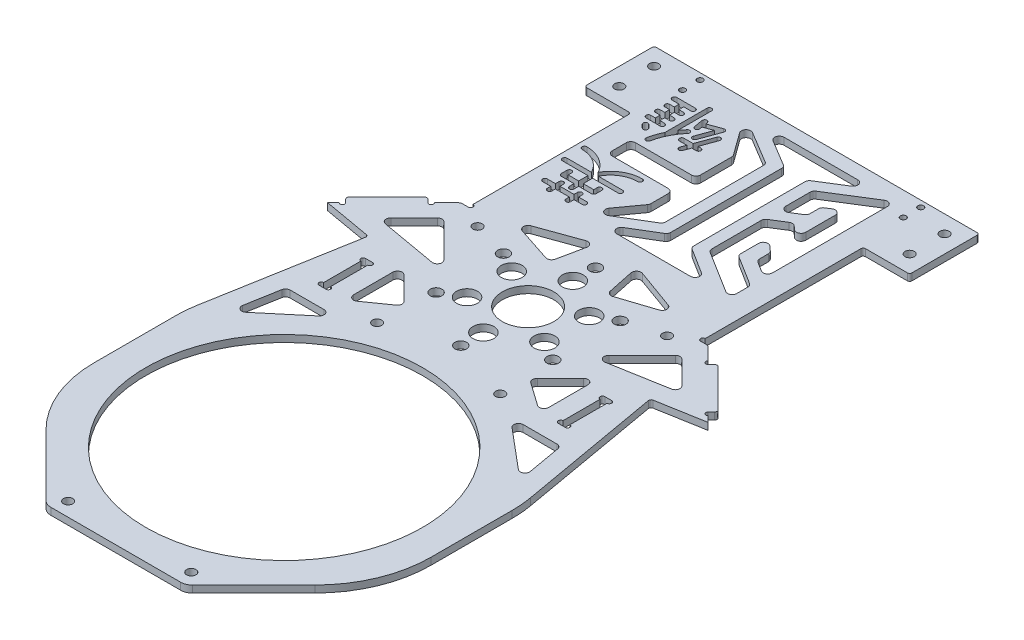
from build123d import *

# Parameters (mm, degrees)
SKETCH_1_R          = 59.6
SKETCH_1_R_2        = 11.1
SKETCH_1_R_3        = 2
SKETCH_1_R_4        = 1.25
EXTRUDE_1_DEPTH     = 3
SKETCH_2_R          = 2.5
SKETCH_2_R_2        = 4.5
SKETCH_2_W          = 3
SKETCH_2_H          = 20
CUT_EXTRUDE_4_DEPTH = 244.455948205
SKETCH_3_R          = 1
CUT_EXTRUDE_5_DEPTH = 244.455948205
CUT_EXTRUDE_7_DEPTH = 244.455948205
CUT_EXTRUDE_8_DEPTH = 244.455948205
FILLET_1_R          = 5
FILLET_2_R          = 1
FILLET_3_R          = 50
FILLET_5_R          = 2


with BuildPart() as part:
    # 草图1 → 凸台-拉伸1 (new body)
    with BuildSketch(Plane(origin=(0, 0, 0), x_dir=(1, 0, 0), z_dir=(0, 1, 0))):
        Polygon((-72.5, 30.030483272), (-60.71293079, 96.878274589), (-81.891612613, 100.612647611), (-78.002525317, 104.501734907), (-80.123845661, 106.623055251), (-62.446176131, 124.300724781), (-60.324855787, 122.179404437), (-53.253787975, 129.250472249), (-50, 129.250472249), (-50, 199.25), (-70, 199.25), (-70, 229.25), (70, 229.25), (70, 199.25), (50, 199.25), (50, 129.250472249), (53.253787975, 129.250472249), (60.324855787, 122.179404437), (62.446176131, 124.300724781), (80.123845661, 106.623055251), (78.002525317, 104.501734907), (81.891612613, 100.612647611), (60.71293079, 96.878274589), (72.5, 30.030483272), (72.5, -30.030483272), (30.030483272, -72.5), (-30.030483272, -72.5), (-72.5, -30.030483272), align=None)
        with Locations(Location((0, 0, 0), (0, 0, 270))):
            Circle(SKETCH_1_R, mode=Mode.SUBTRACT)
        with Locations(Location((0, 105, 0), (0, 0, 270))):
            Circle(SKETCH_1_R_2, mode=Mode.SUBTRACT)
        with Locations(Location((-26.5, -66.5, 0), (0, 0, 270))):
            Circle(SKETCH_1_R_3, mode=Mode.SUBTRACT)
        with Locations(Location((26.5, -66.5, 0), (0, 0, 90))):
            Circle(SKETCH_1_R_3, mode=Mode.SUBTRACT)
        with Locations(Location((26.5, 66.5, 0), (0, 0, 270))):
            Circle(SKETCH_1_R_3, mode=Mode.SUBTRACT)
        with Locations(Location((-26.5, 66.5, 0), (0, 0, 90))):
            Circle(SKETCH_1_R_3, mode=Mode.SUBTRACT)
        with Locations(Location((-40.783850417, 124.017821778, 0), (0, 0, 270))):
            Circle(SKETCH_1_R_3, mode=Mode.SUBTRACT)
        with Locations(Location((40.783850417, 124.017821778, 0), (0, 0, 90))):
            Circle(SKETCH_1_R_3, mode=Mode.SUBTRACT)
        with Locations(Location((-62.5, 221.75, 0), (0, 0, 270))):
            Circle(SKETCH_1_R_3, mode=Mode.SUBTRACT)
        with Locations(Location((-62.5, 206.75, 0), (0, 0, 270))):
            Circle(SKETCH_1_R_3, mode=Mode.SUBTRACT)
        with Locations(Location((62.5, 206.75, 0), (0, 0, 90))):
            Circle(SKETCH_1_R_3, mode=Mode.SUBTRACT)
        with Locations(Location((62.5, 221.75, 0), (0, 0, 90))):
            Circle(SKETCH_1_R_3, mode=Mode.SUBTRACT)
        with Locations(Location((-47.5, 226.5, 0), (0, 0, 270))):
            Circle(SKETCH_1_R_4, mode=Mode.SUBTRACT)
        with Locations(Location((-47.5, 219, 0), (0, 0, 270))):
            Circle(SKETCH_1_R_4, mode=Mode.SUBTRACT)
        with Locations(Location((47.5, 219, 0), (0, 0, 90))):
            Circle(SKETCH_1_R_4, mode=Mode.SUBTRACT)
        with Locations(Location((47.5, 226.5, 0), (0, 0, 90))):
            Circle(SKETCH_1_R_4, mode=Mode.SUBTRACT)
    extrude(amount=EXTRUDE_1_DEPTH)

    # 草图2 → 切除-拉伸4 (cut, through all)
    with BuildSketch(Plane(origin=(0, 3, 0), x_dir=(1, 0, 0), z_dir=(0, 1, 0))):
        with Locations(Location((0, 134, 0), (0, 0, 270))):
            Circle(SKETCH_2_R)
        with Locations(Location((0, 124.25, 0), (0, 0, 270))):
            Circle(SKETCH_2_R_2)
        with Locations(Location((25.11473671, 119.5, 0), (0, 0, 270))):
            Circle(SKETCH_2_R)
        with Locations(Location((16.670989023, 114.625, 0), (0, 0, 270))):
            Circle(SKETCH_2_R_2)
        with Locations(Location((25.11473671, 90.5, 0), (0, 0, 270))):
            Circle(SKETCH_2_R)
        with Locations(Location((16.670989023, 95.375, 0), (0, 0, 270))):
            Circle(SKETCH_2_R_2)
        with Locations(Location((0, 76, 0), (0, 0, 270))):
            Circle(SKETCH_2_R)
        with Locations(Location((0, 85.75, 0), (0, 0, 270))):
            Circle(SKETCH_2_R_2)
        with Locations(Location((-25.11473671, 90.5, 0), (0, 0, 270))):
            Circle(SKETCH_2_R)
        with Locations(Location((-16.670989023, 95.375, 0), (0, 0, 270))):
            Circle(SKETCH_2_R_2)
        with Locations(Location((-25.11473671, 119.5, 0), (0, 0, 270))):
            Circle(SKETCH_2_R)
        with Locations(Location((-16.670989023, 114.625, 0), (0, 0, 270))):
            Circle(SKETCH_2_R_2)
        with Locations((-51.5, 78)):
            Rectangle(SKETCH_2_W, SKETCH_2_H)
        with Locations((51.5, 78)):
            Rectangle(SKETCH_2_W, SKETCH_2_H)
    extrude(amount=-CUT_EXTRUDE_4_DEPTH, mode=Mode.SUBTRACT)

    # 草图3 → 切除-拉伸5 (cut, through all)
    with BuildSketch(Plane(origin=(0, 3, 0), x_dir=(1, 0, 0), z_dir=(0, 1, 0))):
        with Locations((-53, 87)):
            Circle(SKETCH_3_R)
        with Locations((-50, 87)):
            Circle(SKETCH_3_R)
        with Locations((-53, 69)):
            Circle(SKETCH_3_R)
        with Locations((-50, 69)):
            Circle(SKETCH_3_R)
        with Locations((50, 69)):
            Circle(SKETCH_3_R)
        with Locations((53, 69)):
            Circle(SKETCH_3_R)
        with Locations((50, 87)):
            Circle(SKETCH_3_R)
        with Locations((53, 87)):
            Circle(SKETCH_3_R)
        with Locations((-78.709632098, 103.794628126)):
            Circle(SKETCH_3_R)
        with Locations((-59.617749006, 122.886511218)):
            Circle(SKETCH_3_R)
        with Locations((59.617749006, 122.886511218)):
            Circle(SKETCH_3_R)
        with Locations((78.709632098, 103.794628126)):
            Circle(SKETCH_3_R)
        with Locations((-50, 130.250472249)):
            Circle(SKETCH_3_R)
        with Locations((50, 130.250472249)):
            Circle(SKETCH_3_R)
    extrude(amount=-CUT_EXTRUDE_5_DEPTH, mode=Mode.SUBTRACT)

    # 草图4 → 切除-拉伸7 (cut, through all)
    with BuildSketch(Plane(origin=(0, 3, 0), x_dir=(1, 0, 0), z_dir=(0, 1, 0))):
        Polygon((-59.092152707, 60), (-37.395452325, 60), (-62.85974519, 38.632921249), align=None)
        Polygon((-51.225906832, 119.964644893), (-31.02884403, 99.767582091), (-65.368042456, 105.822509269), align=None)
        Polygon((-42, 93.578680003), (-42, 68), (-27, 78.578680003), align=None)
        Polygon((40, 151.25), (40, 160.687681333), (26, 169.449892876), (26, 182.689101668), (32, 177.322538522), (32, 171.59321019), (40, 166.586232166), (40, 223.25), (18, 209.480810432), (18, 194.313800768), (26, 199.320778793), (26, 205.050107124), (32, 208.805340643), (32, 188.055664814), (26, 193.42222796), (18, 188.415249935), (18, 165.019189568), align=None)
        Polygon((30.575471585, 151.25), (-15.2962118, 151.25), (3, 162.25), (3, 212.25), (-15.2962118, 223.25), (30.575471585, 223.25), (13, 212.25), (13, 162.25), align=None)
        Polygon((-25, 151.25), (-2, 165.077999083), (-2, 209.422000917), (-25, 223.25), (-12, 205.25), (-12, 189.25), (-40, 189.25), (-40, 179.25), (-12, 179.25), (-12, 169.25), align=None)
        Polygon((27, 78.578680003), (42, 93.578680003), (42, 68), align=None)
        Polygon((65.368042456, 105.822509269), (51.225906832, 119.964644893), (31.02884403, 99.767582091), align=None)
        Polygon((62.85974519, 38.632921249), (59.092152707, 60), (37.395452325, 60), align=None)
        Polygon((-35, 133.793648759), (-8.789471224, 143.25), (-12.330118304, 126.356391367), align=None)
        Polygon((12.330118304, 126.356391367), (35, 133.793648759), (8.789471224, 143.25), align=None)
    extrude(amount=-CUT_EXTRUDE_7_DEPTH, mode=Mode.SUBTRACT)

    # 草图5 → 切除-拉伸8 (cut, through all)
    with BuildSketch(Plane(origin=(0, 3, 0), x_dir=(1, 0, 0), z_dir=(0, 1, 0))):
        with BuildLine():
            Line((-26.5, 154.75), (-43.5, 154.75))
            ThreePointArc((-43.5, 154.75), (-44.5, 155.75), (-43.5, 156.75))
            Line((-43.5, 156.75), (-26.5, 156.75))
            ThreePointArc((-26.5, 156.75), (-25.5, 155.75), (-26.5, 154.75))
        make_face()
        with BuildLine():
            Line((-32, 153.25), (-32, 158.25))
            ThreePointArc((-32, 158.25), (-31, 159.25), (-30, 158.25))
            Line((-30, 158.25), (-30, 153.25))
            ThreePointArc((-30, 153.25), (-31, 152.25), (-32, 153.25))
        make_face()
        with BuildLine():
            Line((-29.5, 161.75), (-29.5, 164.25))
            ThreePointArc((-29.5, 164.25), (-28.5, 165.25), (-27.5, 164.25))
            Line((-27.5, 164.25), (-27.5, 161.75))
            ThreePointArc((-27.5, 161.75), (-28.5, 160.75), (-29.5, 161.75))
        make_face()
        with BuildLine():
            Line((-28.5, 160.75), (-41.5, 160.75))
            ThreePointArc((-41.5, 160.75), (-42.5, 161.75), (-41.5, 162.75))
            Line((-41.5, 162.75), (-28.5, 162.75))
            ThreePointArc((-28.5, 162.75), (-27.5, 161.75), (-28.5, 160.75))
        make_face()
        with BuildLine():
            Line((-23, 166.75), (-47, 166.75))
            ThreePointArc((-47, 166.75), (-48, 167.75), (-47, 168.75))
            Line((-47, 168.75), (-23, 168.75))
            ThreePointArc((-23, 168.75), (-22, 167.75), (-23, 166.75))
        make_face()
        with BuildLine():
            Line((-34, 167.75), (-34, 158.75))
            ThreePointArc((-34, 158.75), (-35, 157.75), (-36, 158.75))
            Line((-36, 158.75), (-36, 167.75))
            ThreePointArc((-36, 167.75), (-35, 168.75), (-34, 167.75))
        make_face()
        with BuildLine():
            Line((-40.5, 161.75), (-40.5, 164.25))
            ThreePointArc((-40.5, 164.25), (-41.5, 165.25), (-42.5, 164.25))
            Line((-42.5, 164.25), (-42.5, 161.75))
            ThreePointArc((-42.5, 161.75), (-41.5, 160.75), (-40.5, 161.75))
        make_face()
        with BuildLine():
            Line((-38, 153.25), (-38, 158.25))
            ThreePointArc((-38, 158.25), (-39, 159.25), (-40, 158.25))
            Line((-40, 158.25), (-40, 153.25))
            ThreePointArc((-40, 153.25), (-39, 152.25), (-38, 153.25))
        make_face()
        with BuildLine():
            Line((-21.941440666, 199.335786438), (-29.225820612, 199.335786438))
            ThreePointArc((-29.225820612, 199.335786438), (-30.225820612, 200.335786438), (-29.225820612, 201.335786438))
            Line((-29.225820612, 201.335786438), (-21.941440666, 201.335786438))
            ThreePointArc((-21.941440666, 201.335786438), (-20.941440666, 200.335786438), (-21.941440666, 199.335786438))
        make_face()
        with BuildLine():
            Line((-27.992304101, 204.177806581), (-24.843614435, 212.828760341))
            ThreePointArc((-24.843614435, 212.828760341), (-23.56190167, 213.426432819), (-22.964229193, 212.144720055))
            Line((-22.964229193, 212.144720055), (-26.11291886, 203.493766294))
            ThreePointArc((-26.11291886, 203.493766294), (-27.394631624, 202.896093817), (-27.992304101, 204.177806581))
        make_face()
        with BuildLine():
            Line((-23.56190167, 211.547047577), (-30.310683501, 209.090691873))
            ThreePointArc((-30.310683501, 209.090691873), (-31.592396265, 209.688364351), (-30.994723788, 210.970077115))
            Line((-30.994723788, 210.970077115), (-24.245941957, 213.426432819))
            ThreePointArc((-24.245941957, 213.426432819), (-22.964229193, 212.828760341), (-23.56190167, 211.547047577))
        make_face()
        with BuildLine():
            Line((-26.815473538, 197.177806581), (-22.580750692, 208.812611977))
            ThreePointArc((-22.580750692, 208.812611977), (-21.299037928, 209.410284455), (-20.70136545, 208.128571691))
            Line((-20.70136545, 208.128571691), (-24.936088296, 196.493766294))
            ThreePointArc((-24.936088296, 196.493766294), (-26.21780106, 195.896093817), (-26.815473538, 197.177806581))
        make_face()
        with BuildLine():
            Line((-31.290215042, 207.88712081), (-31.984807753, 211.826351822))
            ThreePointArc((-31.984807753, 211.826351822), (-31.173648178, 212.984807753), (-30.015192247, 212.173648178))
            Line((-30.015192247, 212.173648178), (-29.320599536, 208.234417166))
            ThreePointArc((-29.320599536, 208.234417166), (-30.131759112, 207.075961235), (-31.290215042, 207.88712081))
        make_face()
        with BuildLine():
            Line((-35.5, 199.258929649), (-35.5, 217.5))
            ThreePointArc((-35.5, 217.5), (-34.5, 218.5), (-33.5, 217.5))
            Line((-33.5, 217.5), (-33.5, 199.258929649))
            ThreePointArc((-33.5, 199.258929649), (-34.5, 198.258929649), (-35.5, 199.258929649))
        make_face()
        with BuildLine():
            Line((-42, 196.128679656), (-43.414213562, 197.542893219))
            ThreePointArc((-43.414213562, 197.542893219), (-43.414213562, 198.957106781), (-42, 198.957106781))
            Line((-42, 198.957106781), (-40.585786438, 197.542893219))
            ThreePointArc((-40.585786438, 197.542893219), (-40.585786438, 196.128679656), (-42, 196.128679656))
        make_face()
        with BuildLine():
            Line((-39, 200.75), (-45, 200.75))
            ThreePointArc((-45, 200.75), (-46, 201.75), (-45, 202.75))
            Line((-45, 202.75), (-39, 202.75))
            ThreePointArc((-39, 202.75), (-38, 201.75), (-39, 200.75))
        make_face()
        with BuildLine():
            Line((-43, 201.75), (-43, 214))
            ThreePointArc((-43, 214), (-42, 215), (-41, 214))
            Line((-41, 214), (-41, 201.75))
            ThreePointArc((-41, 201.75), (-42, 200.75), (-43, 201.75))
        make_face()
        with BuildLine():
            Line((-38, 213), (-46, 213))
            ThreePointArc((-46, 213), (-47, 214), (-46, 215))
            Line((-46, 215), (-38, 215))
            ThreePointArc((-38, 215), (-37, 214), (-38, 213))
        make_face()
        with BuildLine():
            Line((-39, 204.833333333), (-45, 204.833333333))
            ThreePointArc((-45, 204.833333333), (-46, 205.833333333), (-45, 206.833333333))
            Line((-45, 206.833333333), (-39, 206.833333333))
            ThreePointArc((-39, 206.833333333), (-38, 205.833333333), (-39, 204.833333333))
        make_face()
        with BuildLine():
            Line((-39, 208.916666667), (-45, 208.916666667))
            ThreePointArc((-45, 208.916666667), (-46, 209.916666667), (-45, 210.916666667))
            Line((-45, 210.916666667), (-39, 210.916666667))
            ThreePointArc((-39, 210.916666667), (-38, 209.916666667), (-39, 208.916666667))
        make_face()
        with BuildLine():
            ThreePointArc((-23, 177.25), (-30.930737926, 174.72574766), (-35.943352601, 168.081791908))
            ThreePointArc((-35.943352601, 168.081791908), (-35.331791908, 166.806647399), (-34.056647399, 167.418208092))
            ThreePointArc((-34.056647399, 167.418208092), (-29.774703244, 173.093698698), (-23, 175.25))
            ThreePointArc((-23, 175.25), (-22, 176.25), (-23, 177.25))
        make_face()
        with BuildLine():
            ThreePointArc((-47, 177.25), (-39.069262074, 174.72574766), (-34.056647399, 168.081791908))
            ThreePointArc((-34.056647399, 168.081791908), (-34.668208092, 166.806647399), (-35.943352601, 167.418208092))
            ThreePointArc((-35.943352601, 167.418208092), (-40.225296756, 173.093698698), (-47, 175.25))
            ThreePointArc((-47, 175.25), (-48, 176.25), (-47, 177.25))
        make_face()
        with BuildLine():
            ThreePointArc((-31.757615877, 205.209683482), (-35.397615877, 199.699708207), (-37.532057626, 193.450421372))
            ThreePointArc((-37.532057626, 193.450421372), (-36.752769207, 192.270290209), (-35.572638044, 193.049578628))
            ThreePointArc((-35.572638044, 193.049578628), (-33.602384123, 198.818151091), (-30.242384123, 203.904282114))
            ThreePointArc((-30.242384123, 203.904282114), (-30.347299316, 205.314598675), (-31.757615877, 205.209683482))
        make_face()
    extrude(amount=-CUT_EXTRUDE_8_DEPTH, mode=Mode.SUBTRACT)

    # 圆角1
    fillet_1_edges = [part.edges().sort_by_distance(p)[0] for p in [
        (30.030483272, 1.5, 72.5),
        (-30.030483272, 1.5, 72.5),
    ]]
    fillet(fillet_1_edges, radius=FILLET_1_R)

    # 圆角2
    fillet_2_edges = [part.edges().sort_by_distance(p)[0] for p in [
        (-60.71293079, 1.5, -96.878274589),
        (-80.123845661, 1.5, -106.623055251),
        (-62.446176131, 1.5, -124.300724781),
        (-50, 1.5, -199.25),
        (-70, 1.5, -199.25),
        (-70, 1.5, -229.25),
        (70, 1.5, -229.25),
        (70, 1.5, -199.25),
        (50, 1.5, -199.25),
        (62.446176131, 1.5, -124.300724781),
        (80.123845661, 1.5, -106.623055251),
        (60.71293079, 1.5, -96.878274589),
    ]]
    fillet(fillet_2_edges, radius=FILLET_2_R)

    # 圆角3
    fillet_3_edges = [part.edges().sort_by_distance(p)[0] for p in [
        (-72.5, 1.5, -30.030483272),
        (72.5, 1.5, -30.030483272),
        (72.5, 1.5, 30.030483272),
        (-72.5, 1.5, 30.030483272),
    ]]
    fillet(fillet_3_edges, radius=FILLET_3_R)

    # 圆角5
    fillet_5_edges = [part.edges().sort_by_distance(p)[0] for p in [
        (-12.330118304, 1.5, -126.356391367),
        (-35, 1.5, -133.793648759),
        (-8.789471224, 1.5, -143.25),
        (42, 1.5, -68),
        (27, 1.5, -78.578680003),
        (42, 1.5, -93.578680003),
        (-25, 1.5, -151.25),
        (-12, 1.5, -169.25),
        (-12, 1.5, -179.25),
        (-40, 1.5, -179.25),
        (-40, 1.5, -189.25),
        (-12, 1.5, -189.25),
        (-12, 1.5, -205.25),
        (-25, 1.5, -223.25),
        (-2, 1.5, -209.422000917),
        (-2, 1.5, -165.077999083),
        (65.368042456, 1.5, -105.822509269),
        (31.02884403, 1.5, -99.767582091),
        (51.225906832, 1.5, -119.964644893),
        (40, 1.5, -151.25),
        (18, 1.5, -165.019189568),
        (18, 1.5, -188.415249935),
        (26, 1.5, -193.42222796),
        (32, 1.5, -188.055664814),
        (32, 1.5, -208.805340643),
        (26, 1.5, -205.050107124),
        (26, 1.5, -199.320778793),
        (18, 1.5, -194.313800768),
        (18, 1.5, -209.480810432),
        (40, 1.5, -223.25),
        (40, 1.5, -166.586232166),
        (32, 1.5, -171.59321019),
        (32, 1.5, -177.322538522),
        (26, 1.5, -182.689101668),
        (26, 1.5, -169.449892876),
        (40, 1.5, -160.687681333),
        (-53.253787975, 1.5, -129.250472249),
        (3, 1.5, -162.25),
        (3, 1.5, -212.25),
        (-15.2962118, 1.5, -223.25),
        (30.575471585, 1.5, -223.25),
        (13, 1.5, -212.25),
        (13, 1.5, -162.25),
        (30.575471585, 1.5, -151.25),
        (-15.2962118, 1.5, -151.25),
        (53.253787975, 1.5, -129.250472249),
        (-42, 1.5, -93.578680003),
        (-27, 1.5, -78.578680003),
        (-42, 1.5, -68),
        (-65.368042456, 1.5, -105.822509269),
        (-51.225906832, 1.5, -119.964644893),
        (-31.02884403, 1.5, -99.767582091),
        (62.85974519, 1.5, -38.632921249),
        (37.395452325, 1.5, -60),
        (59.092152707, 1.5, -60),
        (12.330118304, 1.5, -126.356391367),
        (8.789471224, 1.5, -143.25),
        (35, 1.5, -133.793648759),
        (-62.85974519, 1.5, -38.632921249),
        (-59.092152707, 1.5, -60),
        (-37.395452325, 1.5, -60),
    ]]
    fillet(fillet_5_edges, radius=FILLET_5_R)


solid = part.part
